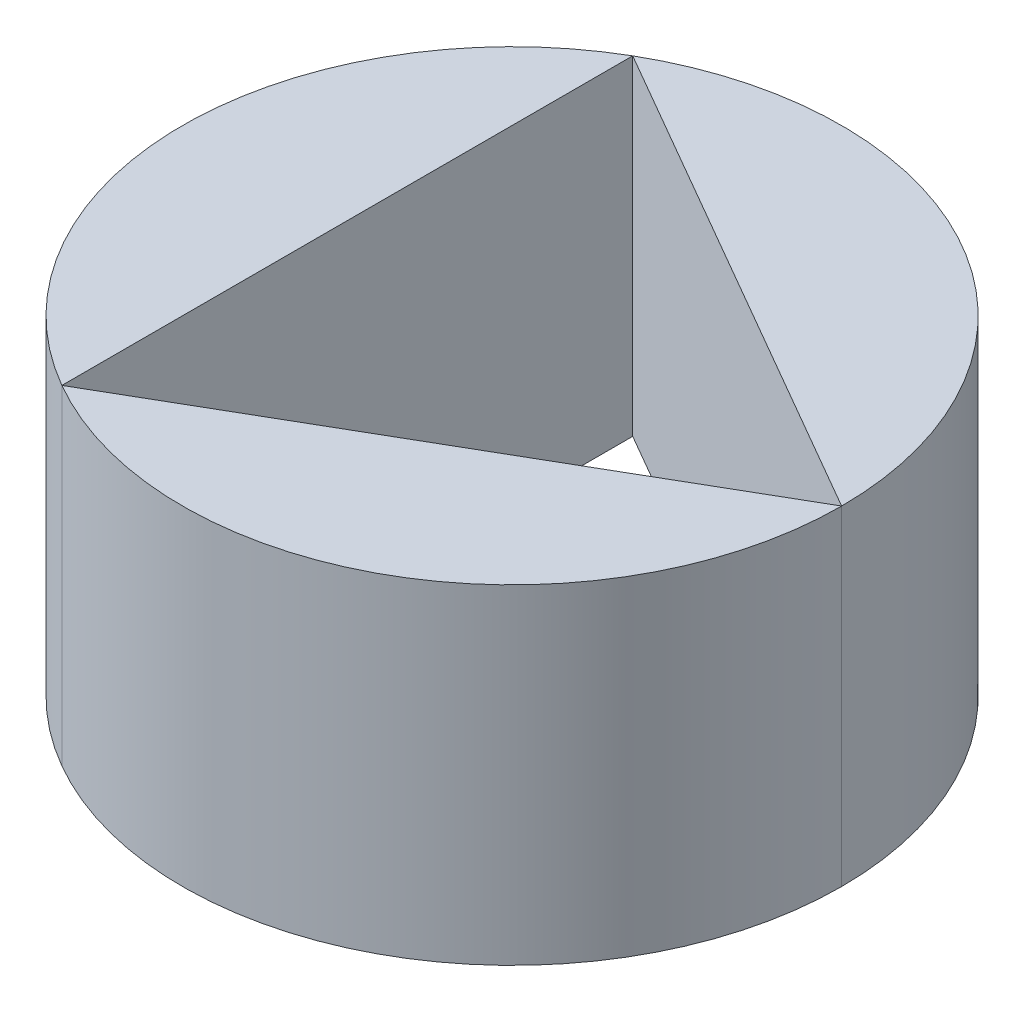
from build123d import *

# Parameters (mm, degrees)
SKETCH_1_R          = 30
EXTRUDE_1_DEPTH     = 30
CUT_EXTRUDE_1_DEPTH = 52.961524227


with BuildPart() as part:
    # 草图1 → 凸台-拉伸1 (new body)
    with BuildSketch(Plane(origin=(0, 0, 0), x_dir=(1, 0, 0), z_dir=(0, 1, 0))):
        with Locations(Location((0, 0, 0), (0, 0, 270))):
            Circle(SKETCH_1_R)
    extrude(amount=EXTRUDE_1_DEPTH)

    # 草图2 → 切除-拉伸1 (cut, through all)
    with BuildSketch(Plane(origin=(0, 30, 0), x_dir=(1, 0, 0), z_dir=(0, 1, 0))):
        Polygon((30, 0), (-15, 25.980762114), (-15, -25.980762114), align=None)
    extrude(amount=-CUT_EXTRUDE_1_DEPTH, mode=Mode.SUBTRACT)


solid = part.part
